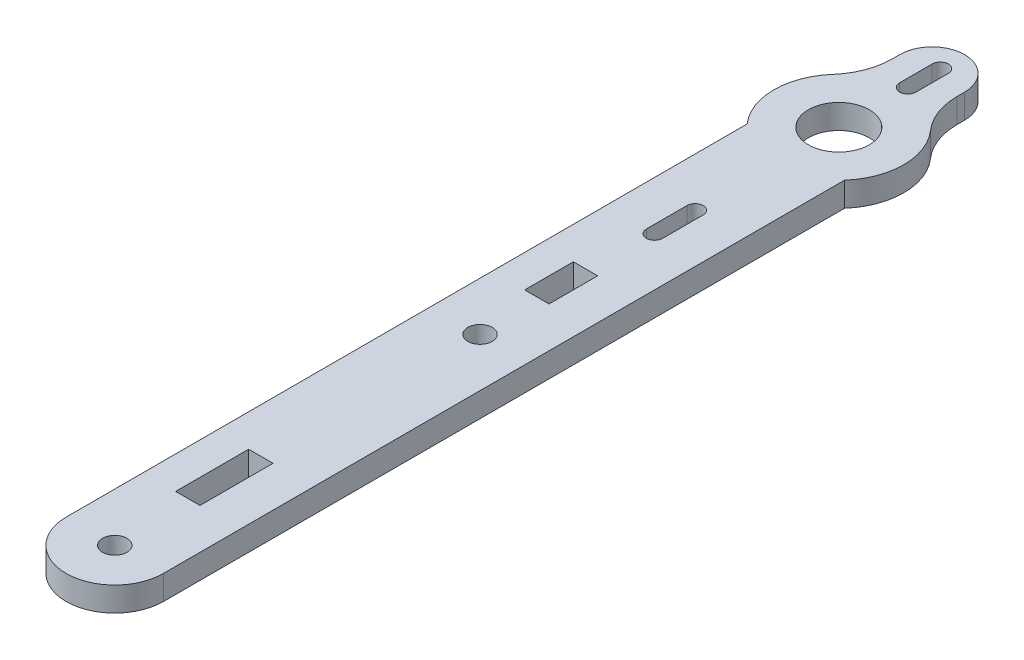
from build123d import *

# Parameters (mm, degrees)
CROQUIS1_R                 = 1.5
CROQUIS1_R_2               = 3.75
CROQUIS1_W                 = 3
CROQUIS1_H                 = 6
CROQUIS1_H_2               = 9
SALIENTE_EXTRUIR1_DEPTH    = 3
S_LIDO_MOVER_COPIAR1_ANGLE = 90


with BuildPart() as part:
    # Croquis1 → Saliente-Extruir1 (new body)
    with BuildSketch(Plane.XY):
        with BuildLine():
            Line((41777.543498403, -351.025953533), (41777.543498403, -434.939495491))
            ThreePointArc((41777.543498403, -434.939495491), (41771.543498403, -440.939495491), (41765.543498403, -434.939495491))
            Line((41765.543498403, -434.939495491), (41765.543498403, -351.025953694))
            ThreePointArc((41765.543498403, -351.025953694), (41763.543498332, -345.734451045), (41765.543498332, -340.44294837))
            ThreePointArc((41765.543498332, -340.44294837), (41767.026813105, -337.979872872), (41767.543498332, -335.151445748))
            Line((41767.543498332, -335.151445748), (41767.543498332, -334.234450911))
            ThreePointArc((41767.543498332, -334.234450911), (41771.543498261, -330.234450982), (41775.54349819, -334.234450911))
            Line((41775.54349819, -334.234450911), (41775.54349819, -335.151445587))
            ThreePointArc((41775.54349819, -335.151445587), (41776.060183455, -337.979872812), (41777.543498332, -340.44294837))
            ThreePointArc((41777.543498332, -340.44294837), (41779.543498332, -345.734450938), (41777.543498403, -351.025953533))
        make_face()
        with Locations((41771.543498403, -434.939495491)):
            Circle(CROQUIS1_R, mode=Mode.SUBTRACT)
        with Locations((41771.543498545, -389.939495491)):
            Circle(CROQUIS1_R, mode=Mode.SUBTRACT)
        with Locations((41771.543498332, -345.734450992)):
            Circle(CROQUIS1_R_2, mode=Mode.SUBTRACT)
        with BuildLine():
            Line((41772.543498261, -333.234450911), (41772.543498261, -337.234450911))
            ThreePointArc((41772.543498261, -337.234450911), (41771.543498261, -338.234450911), (41770.543498261, -337.234450911))
            Line((41770.543498261, -337.234450911), (41770.543498261, -333.234450911))
            ThreePointArc((41770.543498261, -333.234450911), (41771.543498261, -332.234450911), (41772.543498261, -333.234450911))
        make_face(mode=Mode.SUBTRACT)
        with BuildLine():
            Line((41772.543498545, -363.439495491), (41772.543498545, -368.439495491))
            ThreePointArc((41772.543498545, -368.439495491), (41771.543498545, -369.439495491), (41770.543498545, -368.439495491))
            Line((41770.543498545, -368.439495491), (41770.543498545, -363.439495491))
            ThreePointArc((41770.543498545, -363.439495491), (41771.543498545, -362.439495491), (41772.543498545, -363.439495491))
        make_face(mode=Mode.SUBTRACT)
        with Locations((41771.043498545, -379.439495491)):
            Rectangle(CROQUIS1_W, CROQUIS1_H, mode=Mode.SUBTRACT)
        with Locations((41771.043498545, -420.939495491)):
            Rectangle(CROQUIS1_W, CROQUIS1_H_2, mode=Mode.SUBTRACT)
    extrude(amount=SALIENTE_EXTRUIR1_DEPTH)


with BuildPart() as part_1:
    # Sólido-Mover/Copiar1: moved
    add(part.part.rotate(Axis((0, -385.586973236, 1.5), (-1, 0, 0)), S_LIDO_MOVER_COPIAR1_ANGLE))


solid = part_1.part
